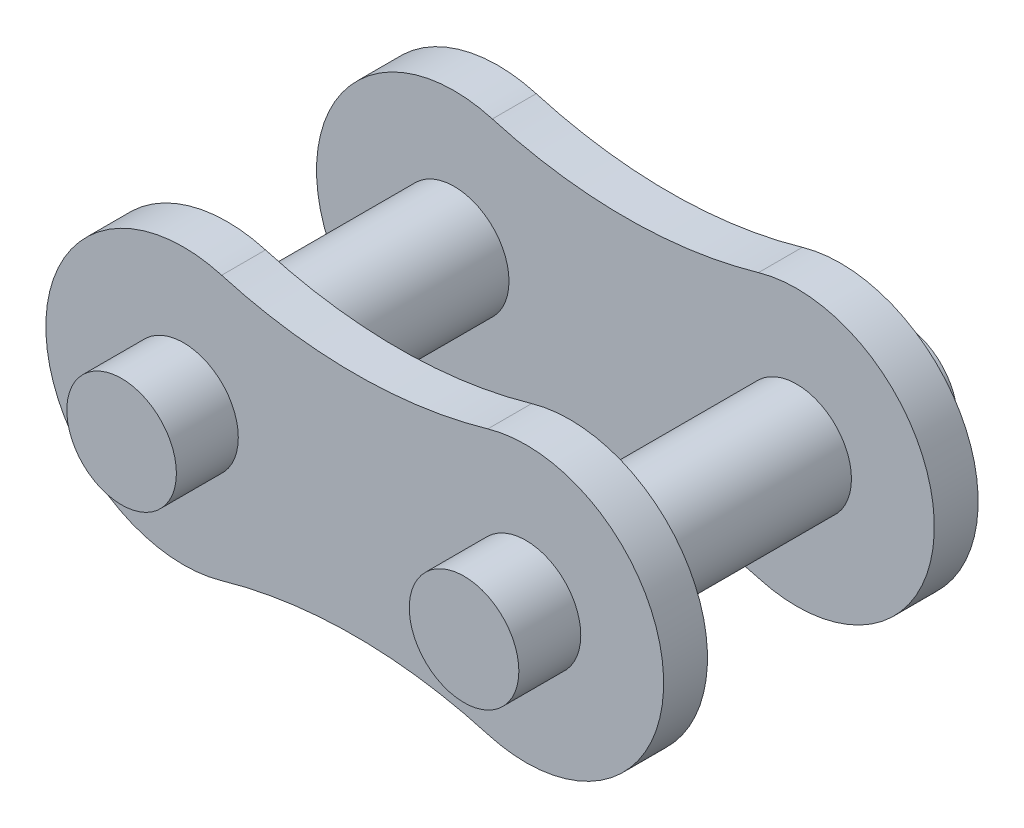
from build123d import *

# Parameters (mm, degrees)
SKETCH4_R                  = 5.08
SKETCH4_R_2                = 2.5654
BOSS_EXTRUDE1_DEPTH        = 3.175
BOSS_EXTRUDE1_2_DEPTH      = 3.175
SKETCH5_R                  = 2.54
BOSS_EXTRUDE2_DEPTH        = 2.032
LPATTERN1_COUNT            = 2
LPATTERN1_PITCH            = 15.875
SKETCH7_R                  = 2.54
BOSS_EXTRUDE3_DEPTH        = 2.032
BOSS_EXTRUDE4_DEPTH        = 10.16
BOSS_EXTRUDE4_DEPTH_BACK   = 10.16
SKETCH8_R                  = 2.54
BOSS_EXTRUDE4_2_DEPTH      = 10.16
BOSS_EXTRUDE4_2_DEPTH_BACK = 10.16


with BuildPart() as part:
    # Sketch4 → Boss-Extrude1 (new, symmetric)
    with BuildSketch(Plane.XY):
        with Locations((-7.9375, 0)):
            Circle(SKETCH4_R)
        with Locations((-7.9375, 0)):
            Circle(SKETCH4_R_2, mode=Mode.SUBTRACT)
    extrude(amount=BOSS_EXTRUDE1_DEPTH, both=True)


with BuildPart() as body_2:
    # Sketch4 → Boss-Extrude1 2 (new, symmetric)
    with BuildSketch(Plane.XY):
        with Locations((7.9375, 0)):
            Circle(SKETCH4_R)
        with Locations((7.9375, 0)):
            Circle(SKETCH4_R_2, mode=Mode.SUBTRACT)
    extrude(amount=BOSS_EXTRUDE1_2_DEPTH, both=True)


with BuildPart() as body_3:
    # Sketch5 → Boss-Extrude2 (new body)
    with BuildSketch(Plane.XY.offset(3.175)):
        with BuildLine():
            ThreePointArc((-5.986592041, 6.984347573), (-15.1892, 0), (-5.986592041, -6.984347573))
            ThreePointArc((-5.986592041, -6.984347573), (0, -6.163945), (5.986592041, -6.984347573))
            ThreePointArc((5.986592041, -6.984347573), (15.1892, 0), (5.986592041, 6.984347573))
            ThreePointArc((5.986592041, 6.984347573), (0, 6.163945), (-5.986592041, 6.984347573))
        make_face()
        with Locations((-7.9375, 0)):
            Circle(SKETCH5_R, mode=Mode.SUBTRACT)
        with Locations((7.9375, 0)):
            Circle(SKETCH5_R, mode=Mode.SUBTRACT)
    extrude(amount=BOSS_EXTRUDE2_DEPTH)


with BuildPart() as lpattern1_1:
    # LPattern1: pattern copy
    add(body_2.part.moved(Location(Vector(1, 0, 0) * (1 * LPATTERN1_PITCH))))


with BuildPart() as body_5:
    # Sketch7 → Boss-Extrude3 (new body)
    with BuildSketch(Plane.XY.offset(-5.2578)):
        with BuildLine():
            ThreePointArc((9.706473173, 6.131412978), (1.556004, 0), (9.706473173, -6.131412978))
            ThreePointArc((9.706473173, -6.131412978), (15.875, -5.259356889), (22.043526827, -6.131412978))
            ThreePointArc((22.043526827, -6.131412978), (30.193996, 0), (22.043526827, 6.131412978))
            ThreePointArc((22.043526827, 6.131412978), (15.875, 5.259356889), (9.706473173, 6.131412978))
        make_face()
        with Locations((7.9375, 0)):
            Circle(SKETCH7_R, mode=Mode.SUBTRACT)
        with Locations((23.8125, 0)):
            Circle(SKETCH7_R, mode=Mode.SUBTRACT)
    extrude(amount=-BOSS_EXTRUDE3_DEPTH)


with BuildPart() as body_6:
    # Mirror1: mirrored copy
    add(body_3.part.mirror(Plane.XY))


with BuildPart() as body_7:
    # Mirror1 2: mirrored copy
    add(body_5.part.mirror(Plane.XY))


with BuildPart() as body_8:
    # Sketch8 → Boss-Extrude4 (new, two sides: drawn at the far end of the back side and taken through both)
    with BuildSketch(Plane.XY.offset(-BOSS_EXTRUDE4_DEPTH_BACK)):
        with Locations((7.9375, 0)):
            Circle(SKETCH8_R)
    extrude(amount=BOSS_EXTRUDE4_DEPTH + BOSS_EXTRUDE4_DEPTH_BACK)


with BuildPart() as body_9:
    # Sketch8 → Boss-Extrude4 2 (new, two sides: drawn at the far end of the back side and taken through both)
    with BuildSketch(Plane.XY.offset(-BOSS_EXTRUDE4_2_DEPTH_BACK)):
        with Locations((23.8125, 0)):
            Circle(SKETCH8_R)
    extrude(amount=BOSS_EXTRUDE4_2_DEPTH + BOSS_EXTRUDE4_2_DEPTH_BACK)


solid = Compound([body_5.part, body_7.part, body_8.part, body_9.part])
